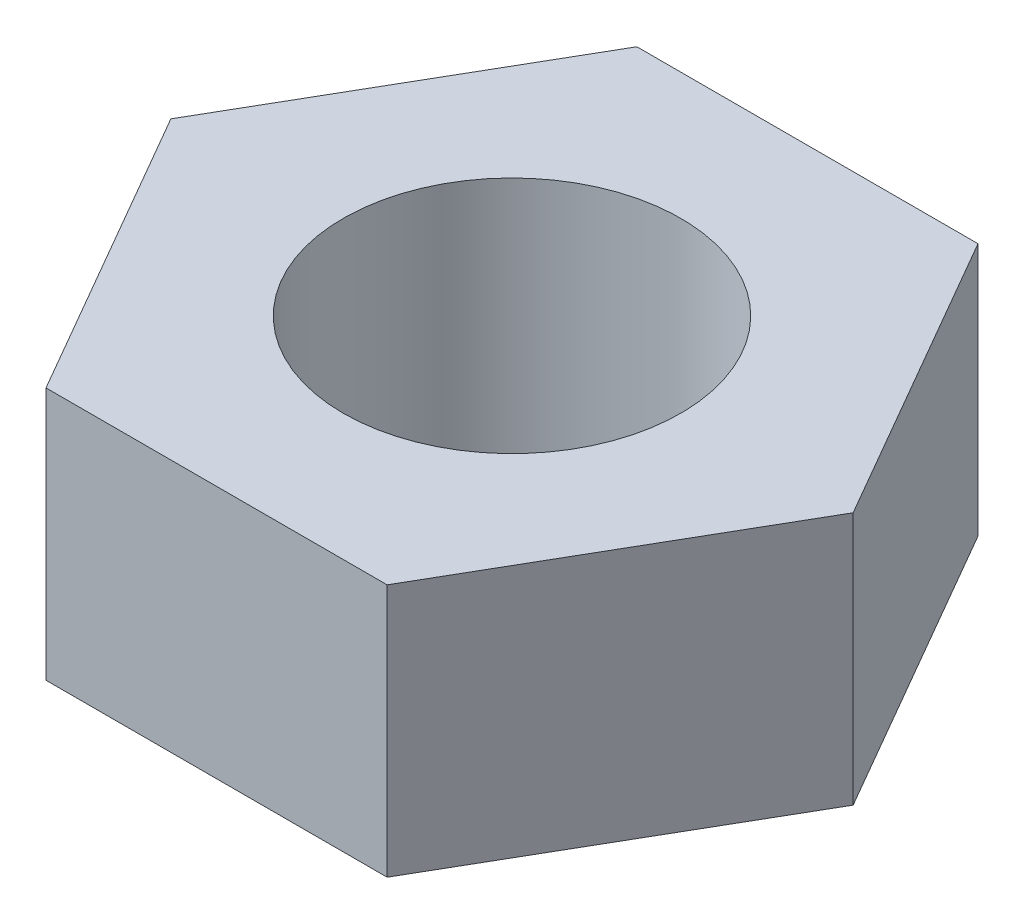
from build123d import *

# Parameters (mm, degrees)
SKETCH_1_R      = 2
EXTRUDE_1_DEPTH = 3


with BuildPart() as part:
    # ｽｹｯﾁ1 → 押し出し1 (new body)
    with BuildSketch(Plane(origin=(0, 0, 0), x_dir=(1, 0, 0), z_dir=(0, 1, 0))):
        Polygon((2.020725942, -3.5), (4.041451884, 0), (2.020725942, 3.5), (-2.020725942, 3.5), (-4.041451884, 0), (-2.020725942, -3.5), align=None)
        with Locations(Location((0, 0, 0), (0, 0, 270))):
            Circle(SKETCH_1_R, mode=Mode.SUBTRACT)
    extrude(amount=EXTRUDE_1_DEPTH)


solid = part.part
